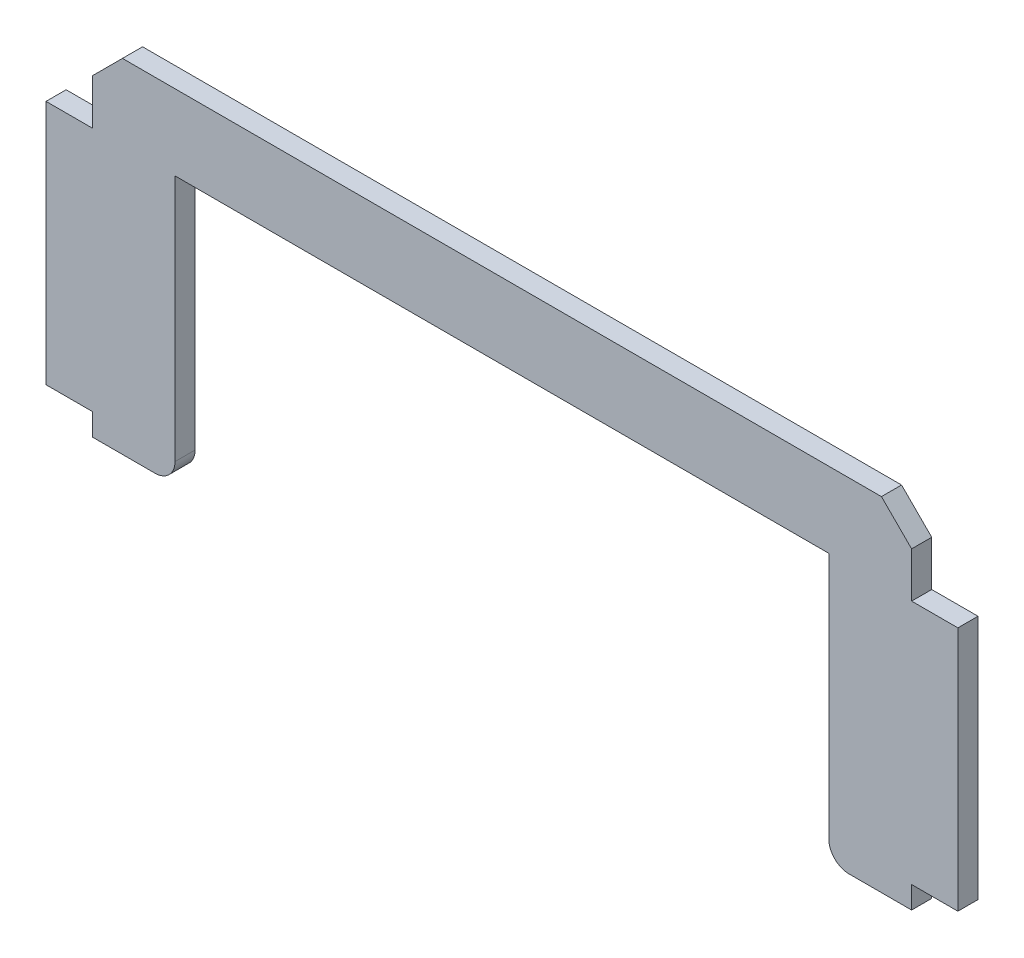
from build123d import *

# Parameters (mm, degrees)
BOSS_EXTRUDE1_DEPTH = 2.54
CHAMFER1_SIZE       = 3.81
FILLET1_R           = 2.54


with BuildPart() as part:
    # Sketch1 → Boss-Extrude1 (new body)
    with BuildSketch(Plane.XY):
        Polygon((5.842, 0), (16.2941, 0), (16.2941, 33.782), (98.8441, 33.782), (98.8441, 0), (109.2962, 0), (109.2962, 2.794), (115.1382, 2.794), (115.1382, 33.782), (109.2962, 33.782), (109.2962, 43.307), (5.842, 43.307), (5.842, 33.782), (0, 33.782), (0, 2.794), (5.842, 2.794), align=None)
    extrude(amount=BOSS_EXTRUDE1_DEPTH)

    # Chamfer1
    chamfer1_edges = [part.edges().sort_by_distance(p)[0] for p in [
        (5.842, 43.307, 1.27),
        (109.2962, 43.307, 1.27),
    ]]
    chamfer(chamfer1_edges, length=CHAMFER1_SIZE)

    # Fillet1
    fillet1_edges = [part.edges().sort_by_distance(p)[0] for p in [
        (16.2941, 0, 1.27),
        (98.8441, 0, 1.27),
    ]]
    fillet(fillet1_edges, radius=FILLET1_R)


solid = part.part
